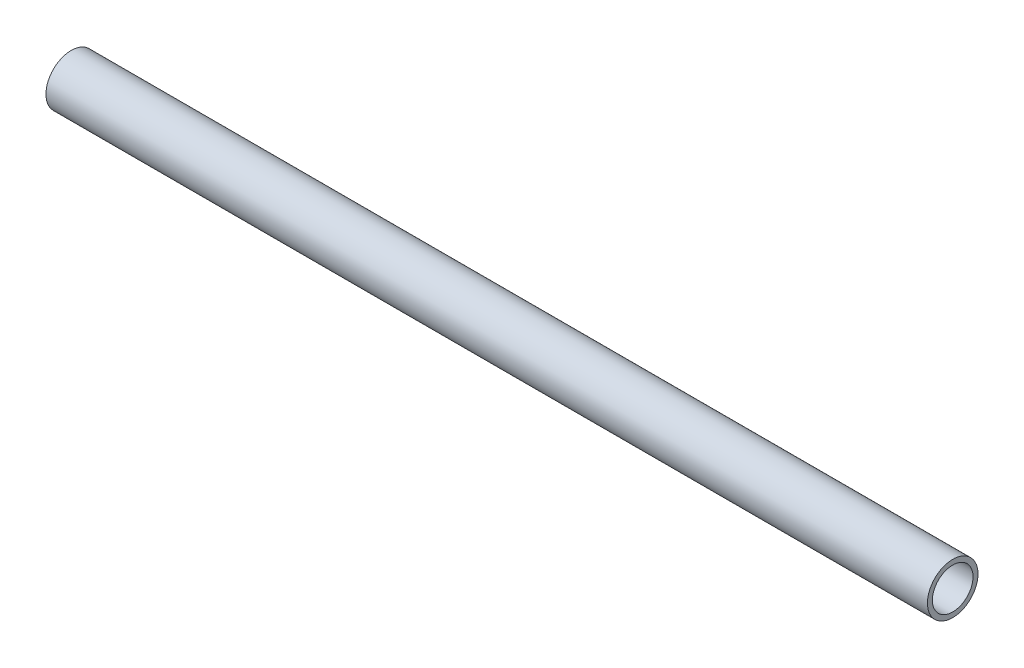
from build123d import *

# Parameters (mm, degrees)
SKIZZE1_R                       = 2.55
SKIZZE1_R_2                     = 2.05
AUFSATZ_LINEAR_AUSTRAGEN1_DEPTH = 88.9


with BuildPart() as part:
    # Skizze1 → Aufsatz-Linear austragen1 (new body)
    with BuildSketch(Plane(origin=(0, 0, 0), x_dir=(0, 0, -1), z_dir=(1, 0, 0))):
        Circle(SKIZZE1_R)
        Circle(SKIZZE1_R_2, mode=Mode.SUBTRACT)
    extrude(amount=AUFSATZ_LINEAR_AUSTRAGEN1_DEPTH)


solid = part.part
